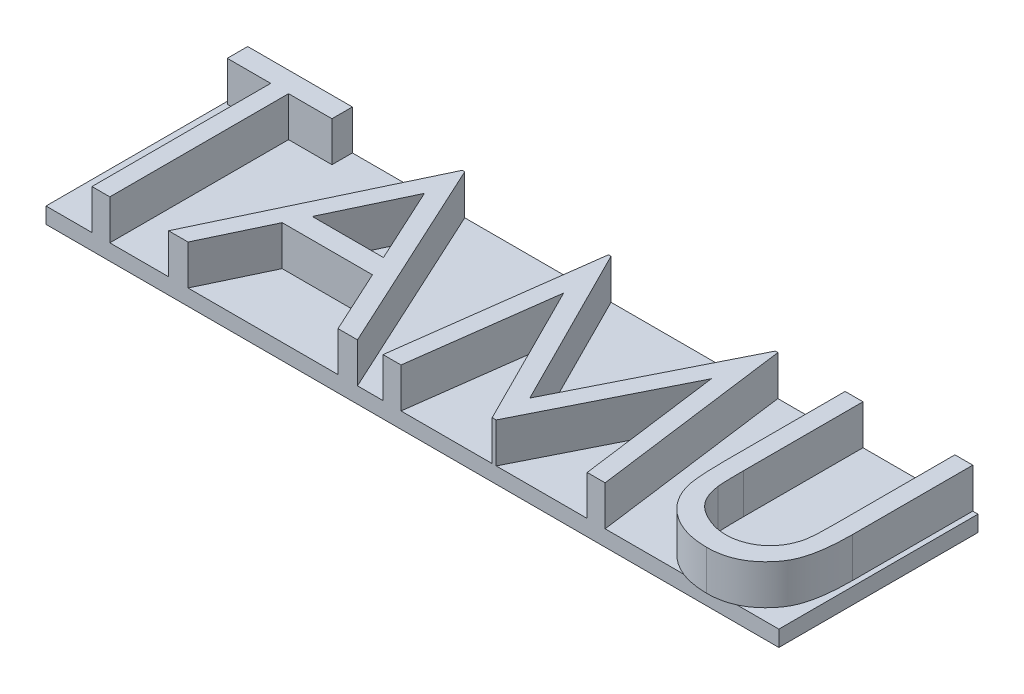
from build123d import *

# Parameters (mm, degrees)
SKETCH2_W           = 116.84
SKETCH2_H           = 31.75
BOSS_EXTRUDE2_DEPTH = 2.54
BOSS_EXTRUDE5_DEPTH = 6.35


with BuildPart() as part:
    # Sketch2 → Boss-Extrude2 (new body)
    with BuildSketch(Plane(origin=(0, 0, 0), x_dir=(1, 0, 0), z_dir=(0, 1, 0))):
        with Locations((58.42, -15.875)):
            Rectangle(SKETCH2_W, SKETCH2_H)
    extrude(amount=BOSS_EXTRUDE2_DEPTH)

    # Sketch6 → Boss-Extrude5 (add)
    # profile 1 of 4: a face of its own
    with BuildSketch(Plane(origin=(0, 2.54, 0), x_dir=(1, 0, 0), z_dir=(0, 1, 0))):
        Polygon((0.407051282, -3.256410256), (0.407051282, 0), (17.096153846, 0), (17.096153846, -3.256410256), (10.176282051, -3.256410256), (10.176282051, -31.75), (7.326923077, -31.75), (7.326923077, -3.256410256), align=None)
    # profile 2 of 4: a face of its own
    with BuildSketch(Plane(origin=(0, 2.54, 0), x_dir=(1, 0, 0), z_dir=(0, 1, 0))):
        Polygon((35.006410256, 0), (49.66025641, -31.75), (46.562850561, -31.75), (41.869040465, -21.573717949), (27.475961538, -21.573717949), (22.64858774, -31.75), (19.538461538, -31.75), (34.599358974, 0), align=None)
        Polygon((34.771083734, -6.188451522), (29.021484375, -18.317307692), (40.368038862, -18.317307692), align=None, mode=Mode.SUBTRACT)
    # profile 3 of 4: a face of its own
    with BuildSketch(Plane(origin=(0, 2.54, 0), x_dir=(1, 0, 0), z_dir=(0, 1, 0))):
        Polygon((53.730769231, -31.75), (57.922125401, 0), (58.329176683, 0), (71.4375, -26.051282051), (84.514022436, 0), (84.927433894, 0), (89.144230769, -31.75), (86.282151442, -31.75), (83.241987179, -8.904246795), (71.780949519, -31.75), (71.138571715, -31.75), (59.633012821, -8.853365385), (56.599208734, -31.75), align=None)
    # profile 4 of 4: a face of its own
    with BuildSketch(Plane(origin=(0, 2.54, 0), x_dir=(1, 0, 0), z_dir=(0, 1, 0))):
        with BuildLine():
            Line((95.657051282, 0), (98.506410256, 0))
            Line((98.506410256, 0), (98.506410256, -19.02328726))
            add(Edge.make_bspline(
                [(98.506410256, -19.02328726), (98.505986222, -19.292533934), (98.505181543, -19.803475897), (98.51055649, -20.530716909), (98.525609332, -21.177259931), (98.535099494, -21.745597155), (98.556211734, -22.23312065), (98.573429731, -22.642471683), (98.595569067, -22.971711948), (98.622176633, -23.163853206), (98.633613782, -23.246444311)],
                knots=[0, 0, 0, 0, 1.528628734, 2.90083645, 4.128790002, 5.200304208, 6.127813768, 6.898992206, 7.526736466, 8, 8, 8, 8], degree=3))
            add(Edge.make_bspline(
                [(98.633613782, -23.246444311), (98.68058073, -23.544411378), (98.771868206, -24.123556136), (99.00451749, -24.948224121), (99.329433392, -25.691459492), (99.714452422, -26.376454776), (100.221841111, -26.984143971), (100.829658895, -27.543956821), (101.566057224, -28.033558192), (102.384849861, -28.481240556), (103.267365944, -28.841059518), (104.169168146, -29.11314218), (105.076700886, -29.278957914), (105.684270383, -29.298157946), (105.985977564, -29.307692308)],
                knots=[0, 0, 0, 0, 1.035780045, 2.013197591, 2.933192213, 3.817615948, 4.702609284, 5.640816605, 6.646850145, 7.73207398, 8.84249596, 9.914020372, 10.964143139, 12, 12, 12, 12], degree=3))
            add(Edge.make_bspline(
                [(105.985977564, -29.307692308), (106.245000781, -29.297950952), (106.761551163, -29.278524503), (107.529052356, -29.158224378), (108.276539056, -28.941412104), (109.007702367, -28.661651438), (109.693057725, -28.292012576), (110.332987521, -27.865012818), (110.904160353, -27.3641713), (111.425386476, -26.809903889), (111.879274822, -26.184521418), (112.272713036, -25.501641166), (112.594983969, -24.750986376), (112.754128801, -24.223442688), (112.83588742, -23.952423878)],
                knots=[0, 0, 0, 0, 0.994687771, 1.983630487, 2.973142513, 3.978332533, 4.983357753, 5.956394766, 6.925816176, 7.893390482, 8.871859704, 9.88551698, 10.913711441, 12, 12, 12, 12], degree=3))
            add(Edge.make_bspline(
                [(112.83588742, -23.952423878), (112.863102842, -23.840404668), (112.923749771, -23.590780724), (112.980419393, -23.16876616), (113.039442874, -22.670841216), (113.080396473, -22.093428342), (113.12032183, -21.438462376), (113.144207562, -20.702531326), (113.155247789, -19.888307468), (113.158537818, -19.320098929), (113.16025641, -19.02328726)],
                knots=[0, 0, 0, 0, 0.558680831, 1.244966039, 2.062412453, 2.990489873, 4.051219941, 5.244515665, 6.560634259, 8, 8, 8, 8], degree=3))
            Line((113.16025641, -19.02328726), (113.16025641, 0))
            Line((113.16025641, 0), (116.009615385, 0))
            Line((116.009615385, 0), (116.009615385, -19.17593149))
            add(Edge.make_bspline(
                [(116.009615385, -19.17593149), (116.00731015, -19.521538214), (116.002811344, -20.196010747), (115.963798971, -21.184355218), (115.901596187, -22.121914406), (115.813711389, -23.008814339), (115.697261431, -23.841881355), (115.567764788, -24.628417466), (115.402850453, -25.362776756), (115.21023317, -26.050685116), (114.990037413, -26.705510845), (114.704821282, -27.32698185), (114.383470461, -27.933991046), (114.002337538, -28.517357463), (113.574062853, -29.079664052), (113.089179749, -29.617500661), (112.563724861, -30.139462009), (111.988963142, -30.632159109), (111.374369091, -31.083994964), (110.721770904, -31.481303316), (110.036181635, -31.817160417), (109.31938342, -32.093620589), (108.571070365, -32.301488739), (107.791223602, -32.456384795), (106.978068062, -32.544398494), (106.425031538, -32.557478859), (106.144981971, -32.564102564)],
                knots=[0, 0, 0, 0, 1.316592851, 2.569410997, 3.76748051, 4.895814652, 5.963796859, 6.97159953, 7.931736103, 8.829262218, 9.692595152, 10.560224239, 11.431080259, 12.30701507, 13.211635791, 14.121146779, 15.063487852, 16.031507147, 17.00238618, 17.966455255, 18.938106653, 19.907068911, 20.888905087, 21.893141452, 22.933117798, 24, 24, 24, 24], degree=3))
            add(Edge.make_bspline(
                [(106.144981971, -32.564102564), (105.839555112, -32.556983622), (105.240308706, -32.543016283), (104.357313382, -32.462981336), (103.510820315, -32.312228759), (102.691889145, -32.120277841), (101.911669207, -31.855539652), (101.159707247, -31.546220948), (100.448882068, -31.166334373), (99.767661973, -30.743665736), (99.134251685, -30.268099376), (98.552796671, -29.749756369), (98.022336988, -29.196940088), (97.551813814, -28.603665342), (97.133431504, -27.974546285), (96.773021711, -27.307803182), (96.463565853, -26.603694171), (96.303849138, -26.114261567), (96.223106971, -25.866836939)],
                knots=[0, 0, 0, 0, 1.13879206, 2.234305948, 3.301075583, 4.341971843, 5.366689343, 6.369221514, 7.369726634, 8.367512178, 9.355451585, 10.318319045, 11.268648973, 12.207971039, 13.137398894, 14.081662264, 15.030215811, 16, 16, 16, 16], degree=3))
            add(Edge.make_bspline(
                [(96.223106971, -25.866836939), (96.176142751, -25.697812871), (96.07427631, -25.331195903), (95.965189682, -24.724439899), (95.87348587, -24.025804575), (95.787256877, -23.235242108), (95.736375616, -22.352139747), (95.691767422, -21.376880296), (95.656737023, -20.308284501), (95.656943601, -19.563932823), (95.657051282, -19.17593149)],
                knots=[0, 0, 0, 0, 0.625038921, 1.35572334, 2.194682327, 3.136881307, 4.189498639, 5.346923369, 6.617055217, 8, 8, 8, 8], degree=3))
            Line((95.657051282, -19.17593149), (95.657051282, 0))
        make_face()
    extrude(amount=BOSS_EXTRUDE5_DEPTH)


solid = part.part
